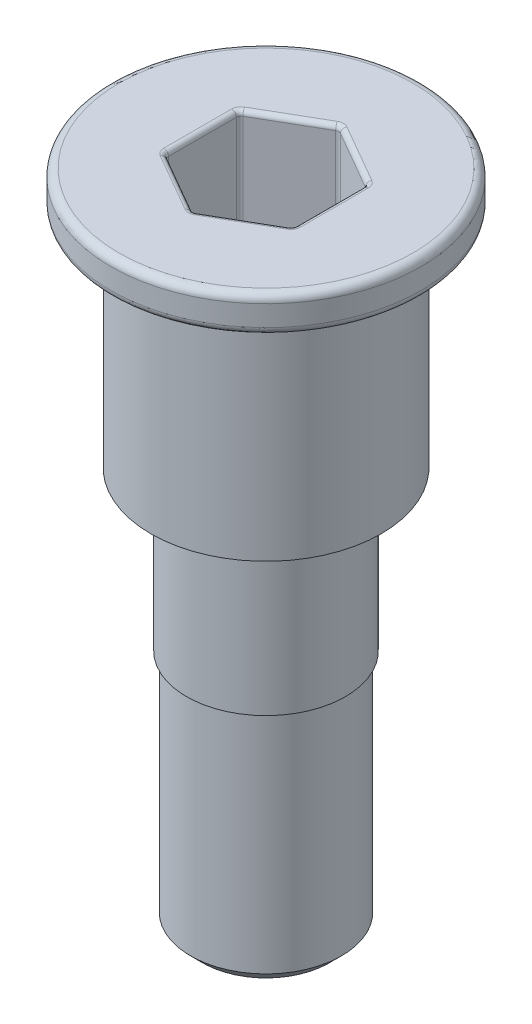
from build123d import *

# Parameters (mm, degrees)
FILETE1_R             = 0.5
CORTE_EXTRUS_O1_DEPTH = 6.5
FILETE2_R             = 0.3
CHANFRO1_SIZE         = 0.75


with BuildPart() as part:
    # Esboço1 → Revolução1 (revolve)
    with BuildSketch(Plane.XY, mode=Mode.PRIVATE) as revolu_o1_sk:
        Polygon((0, 17.056706853), (9.75, 17.056706853), (9.75, 14.756706853), (7.25, 14.756706853), (7.25, 0.756706853), (5, 0.756706853), (5, -9.243293147), (4.75, -9.243293147), (4.75, -24.243293147), (0, -24.243293147), align=None)
    revolve(revolu_o1_sk.sketch.rotate(Axis((0, -39.808803987, 0), (0, 1, 0)), 90), axis=Axis((0, -39.808803987, 0), (0, 1, 0)))

    # Filete1
    filete1_edges = [part.edges().sort_by_distance(p)[0] for p in [
        (0, 14.756706853, 9.75),
        (0, 17.056706853, 9.75),
    ]]
    fillet(filete1_edges, radius=FILETE1_R)

    # Esboço2 → Corte-extrusão1 (cut)
    with BuildSketch(Plane(origin=(0, 17.056706853, 0), x_dir=(1, 0, 0), z_dir=(0, 1, 0))):
        Polygon((0, 4.618802154), (-4, 2.309401077), (-4, -2.309401077), (0, -4.618802154), (4, -2.309401077), (4, 2.309401077), align=None)
    extrude(amount=-CORTE_EXTRUS_O1_DEPTH, mode=Mode.SUBTRACT)

    # Filete2
    filete2_edges = [part.edges().sort_by_distance(p)[0] for p in [
        (2, 10.556706853, -3.464101615),
        (0, 13.806706853, -4.618802154),
        (4, 10.556706853, 0),
        (4, 13.806706853, -2.309401077),
        (2, 10.556706853, 3.464101615),
        (4, 13.806706853, 2.309401077),
        (-2, 10.556706853, 3.464101615),
        (0, 13.806706853, 4.618802154),
        (-4, 10.556706853, 0),
        (-4, 13.806706853, 2.309401077),
        (-2, 10.556706853, -3.464101615),
        (-4, 13.806706853, -2.309401077),
        (2, 17.056706853, -3.464101615),
        (-2, 17.056706853, -3.464101615),
        (-4, 17.056706853, 0),
        (-2, 17.056706853, 3.464101615),
        (2, 17.056706853, 3.464101615),
        (4, 17.056706853, 0),
    ]]
    fillet(filete2_edges, radius=FILETE2_R)

    # Chanfro1
    chanfro1_edges = [part.edges().sort_by_distance(p)[0] for p in [
        (0, -24.243293147, 4.75),
    ]]
    chamfer(chanfro1_edges, length=CHANFRO1_SIZE)


solid = part.part
